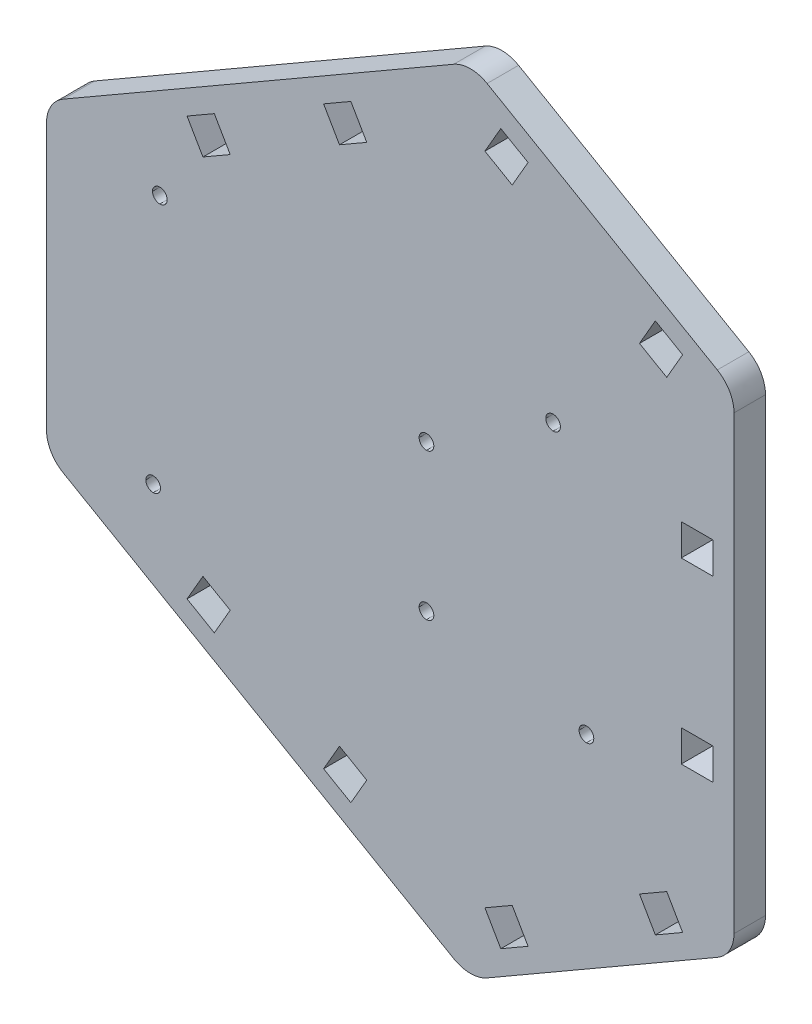
from build123d import *

# Parameters (mm, degrees)
CORTE_W                 = 6.05
CORTE_H                 = 6
SALIENTE_EXTRUIR1_DEPTH = 6


with BuildPart() as part:
    # Corte → Saliente-Extruir1 (new body)
    with BuildSketch(Plane.XY):
        with BuildLine():
            Line((113.357081542, 26.21056425), (157.224997542, 51.53767625))
            add(Edge.make_bspline(
                [(157.224997542, 51.53767625), (159.190322542, 52.67288025), (160.400350542, 54.76749825), (160.399997542, 57.03698825)],
                knots=[0, 0, 0, 0, 1, 1, 1, 1], degree=3))
            Line((160.399997542, 57.03698825), (160.399997542, 142.96314225))
            add(Edge.make_bspline(
                [(160.399997542, 142.96314225), (160.399645542, 145.23256125), (159.190675542, 147.32841425), (157.224997542, 148.46259425)],
                knots=[0, 0, 0, 0, 1, 1, 1, 1], degree=3))
            Line((157.224997542, 148.46259425), (113.357081542, 173.78956925))
            add(Edge.make_bspline(
                [(113.357081542, 173.78956925), (111.391403542, 174.92375025), (108.972053542, 174.92480825), (107.007081542, 173.78956925)],
                knots=[0, 0, 0, 0, 1, 1, 1, 1], degree=3))
            Line((107.007081542, 173.78956925), (32.592792542, 130.82652825))
            add(Edge.make_bspline(
                [(32.592792542, 130.82652825), (30.627711542, 129.69128925), (29.417379542, 127.59649425), (29.417792542, 125.32707525)],
                knots=[0, 0, 0, 0, 1, 1, 1, 1], degree=3))
            Line((29.417792542, 125.32707525), (29.417792542, 74.67277225))
            add(Edge.make_bspline(
                [(29.417792542, 74.67277225), (29.418206542, 72.40335325), (30.627157542, 70.30785325), (32.592792542, 69.17367225)],
                knots=[0, 0, 0, 0, 1, 1, 1, 1], degree=3))
            Line((32.592792542, 69.17367225), (107.007081542, 26.21056425))
            add(Edge.make_bspline(
                [(107.007081542, 26.21056425), (108.972758542, 25.07630125), (111.391756542, 25.07533725), (113.357081542, 26.21056425)],
                knots=[0, 0, 0, 0, 1, 1, 1, 1], degree=3))
        make_face()
        Polygon((82.209667177, 45.146306921), (87.405777131, 42.146233364), (90.430851301, 47.385644235), (85.234741347, 50.385717791), align=None, mode=Mode.SUBTRACT)
        Polygon((59.219111627, 65.405686508), (64.415251823, 62.405665331), (61.39023047, 57.166223967), (56.194090274, 60.166245143), align=None, mode=Mode.SUBTRACT)
        Polygon((115.970526872, 32.338235445), (121.166681404, 35.338231793), (118.141685086, 40.577687612), (112.945530555, 37.577691264), align=None, mode=Mode.SUBTRACT)
        Polygon((147.586560764, 57.577666916), (150.611557081, 52.338211097), (145.41540255, 49.338214749), (142.390406233, 54.577670568), align=None, mode=Mode.SUBTRACT)
        Polygon((59.219036883, 134.594225381), (64.415170597, 137.594257784), (61.390137924, 142.833692613), (56.194004209, 139.83366021), align=None, mode=Mode.SUBTRACT)
        Polygon((82.20954866, 154.853654641), (87.405652132, 157.853739425), (90.430737623, 152.61433509), (85.234634151, 149.614250307), align=None, mode=Mode.SUBTRACT)
        Polygon((112.945395686, 162.422336706), (115.970380683, 167.661799061), (121.166541696, 164.66181394), (118.141556699, 159.422351585), align=None, mode=Mode.SUBTRACT)
        Polygon((147.586469106, 142.422435899), (150.611454103, 147.661898254), (145.41529309, 150.661883375), (142.390308093, 145.42242102), align=None, mode=Mode.SUBTRACT)
        with Locations((153.374997542, 83.000060929)):
            Rectangle(CORTE_W, CORTE_H, mode=Mode.SUBTRACT)
        Polygon((150.349997542, 120.000060929), (156.399997542, 120.000060929), (156.399997542, 114.000060929), (150.349997542, 114.000054393), align=None, mode=Mode.SUBTRACT)
        with BuildLine():
            add(Edge.make_bspline(
                [(51.13479556, 75.869945702), (51.134797227, 75.098420702), (50.509323579, 74.47294435), (49.737798579, 74.472942683)],
                knots=[0, 0, 0, 0, 1, 1, 1, 1], degree=3))
            add(Edge.make_bspline(
                [(49.737798579, 74.472942683), (48.966273579, 74.472941016), (48.340797227, 75.098414665), (48.34079556, 75.869939665)],
                knots=[0, 0, 0, 0, 1, 1, 1, 1], degree=3))
            add(Edge.make_bspline(
                [(48.34079556, 75.869939665), (48.340793893, 76.641464665), (48.966267542, 77.266941016), (49.737792542, 77.266942683)],
                knots=[0, 0, 0, 0, 1, 1, 1, 1], degree=3))
            add(Edge.make_bspline(
                [(49.737792542, 77.266942683), (50.509317542, 77.26694435), (51.134793893, 76.641470702), (51.13479556, 75.869945702)],
                knots=[0, 0, 0, 0, 1, 1, 1, 1], degree=3))
        make_face(mode=Mode.SUBTRACT)
        with BuildLine():
            add(Edge.make_bspline(
                [(52.40444356, 124.12993061), (52.404445227, 123.35840561), (51.778971579, 122.732929259), (51.007798579, 122.732927592)],
                knots=[0, 0, 0, 0, 1, 1, 1, 1], degree=3))
            add(Edge.make_bspline(
                [(51.007798579, 122.732927592), (50.235921579, 122.732925925), (49.610445227, 123.358399573), (49.61044356, 124.129924573)],
                knots=[0, 0, 0, 0, 1, 1, 1, 1], degree=3))
            add(Edge.make_bspline(
                [(49.61044356, 124.129924573), (49.610441893, 124.901449573), (50.235915542, 125.526925925), (51.007792542, 125.526927592)],
                knots=[0, 0, 0, 0, 1, 1, 1, 1], degree=3))
            add(Edge.make_bspline(
                [(51.007792542, 125.526927592), (51.778965542, 125.526929259), (52.404441893, 124.90145561), (52.40444356, 124.12993061)],
                knots=[0, 0, 0, 0, 1, 1, 1, 1], degree=3))
        make_face(mode=Mode.SUBTRACT)
        with BuildLine():
            add(Edge.make_bspline(
                [(103.20479556, 108.88993061), (103.204797227, 108.11840561), (102.579323579, 107.492929259), (101.807798579, 107.492927592)],
                knots=[0, 0, 0, 0, 1, 1, 1, 1], degree=3))
            add(Edge.make_bspline(
                [(101.807798579, 107.492927592), (101.036273579, 107.492925925), (100.410797227, 108.118399573), (100.41079556, 108.889924573)],
                knots=[0, 0, 0, 0, 1, 1, 1, 1], degree=3))
            add(Edge.make_bspline(
                [(100.41079556, 108.889924573), (100.410793893, 109.661449573), (101.036267542, 110.286925925), (101.807792542, 110.286927592)],
                knots=[0, 0, 0, 0, 1, 1, 1, 1], degree=3))
            add(Edge.make_bspline(
                [(101.807792542, 110.286927592), (102.579317542, 110.286929259), (103.204793893, 109.66145561), (103.20479556, 108.88993061)],
                knots=[0, 0, 0, 0, 1, 1, 1, 1], degree=3))
        make_face(mode=Mode.SUBTRACT)
        with BuildLine():
            add(Edge.make_bspline(
                [(103.20479556, 80.94993061), (103.204797227, 80.17840561), (102.579323579, 79.552929259), (101.807798579, 79.552927592)],
                knots=[0, 0, 0, 0, 1, 1, 1, 1], degree=3))
            add(Edge.make_bspline(
                [(101.807798579, 79.552927592), (101.036273579, 79.552925925), (100.410797227, 80.178399573), (100.41079556, 80.949924573)],
                knots=[0, 0, 0, 0, 1, 1, 1, 1], degree=3))
            add(Edge.make_bspline(
                [(100.41079556, 80.949924573), (100.410793893, 81.721449573), (101.036267542, 82.346925925), (101.807792542, 82.346927592)],
                knots=[0, 0, 0, 0, 1, 1, 1, 1], degree=3))
            add(Edge.make_bspline(
                [(101.807792542, 82.346927592), (102.579317542, 82.346929259), (103.204793893, 81.72145561), (103.20479556, 80.94993061)],
                knots=[0, 0, 0, 0, 1, 1, 1, 1], degree=3))
        make_face(mode=Mode.SUBTRACT)
        with BuildLine():
            add(Edge.make_bspline(
                [(133.68479556, 75.86993061), (133.684797227, 75.09840561), (133.059323579, 74.472929259), (132.287798579, 74.472927592)],
                knots=[0, 0, 0, 0, 1, 1, 1, 1], degree=3))
            add(Edge.make_bspline(
                [(132.287798579, 74.472927592), (131.516273579, 74.472925925), (130.890797227, 75.098399573), (130.89079556, 75.869924573)],
                knots=[0, 0, 0, 0, 1, 1, 1, 1], degree=3))
            add(Edge.make_bspline(
                [(130.89079556, 75.869924573), (130.890793893, 76.641449573), (131.516267542, 77.266925925), (132.287792542, 77.266927592)],
                knots=[0, 0, 0, 0, 1, 1, 1, 1], degree=3))
            add(Edge.make_bspline(
                [(132.287792542, 77.266927592), (133.059317542, 77.266929259), (133.684793893, 76.64145561), (133.68479556, 75.86993061)],
                knots=[0, 0, 0, 0, 1, 1, 1, 1], degree=3))
        make_face(mode=Mode.SUBTRACT)
        with BuildLine():
            add(Edge.make_bspline(
                [(127.33479556, 124.12993061), (127.334797227, 123.35840561), (126.709323579, 122.732929259), (125.937798579, 122.732927592)],
                knots=[0, 0, 0, 0, 1, 1, 1, 1], degree=3))
            add(Edge.make_bspline(
                [(125.937798579, 122.732927592), (125.166273579, 122.732925925), (124.540797227, 123.358399573), (124.54079556, 124.129924573)],
                knots=[0, 0, 0, 0, 1, 1, 1, 1], degree=3))
            add(Edge.make_bspline(
                [(124.54079556, 124.129924573), (124.540793893, 124.901449573), (125.166267542, 125.526925925), (125.937792542, 125.526927592)],
                knots=[0, 0, 0, 0, 1, 1, 1, 1], degree=3))
            add(Edge.make_bspline(
                [(125.937792542, 125.526927592), (126.709317542, 125.526929259), (127.334793893, 124.90145561), (127.33479556, 124.12993061)],
                knots=[0, 0, 0, 0, 1, 1, 1, 1], degree=3))
        make_face(mode=Mode.SUBTRACT)
    extrude(amount=-SALIENTE_EXTRUIR1_DEPTH)


solid = part.part
